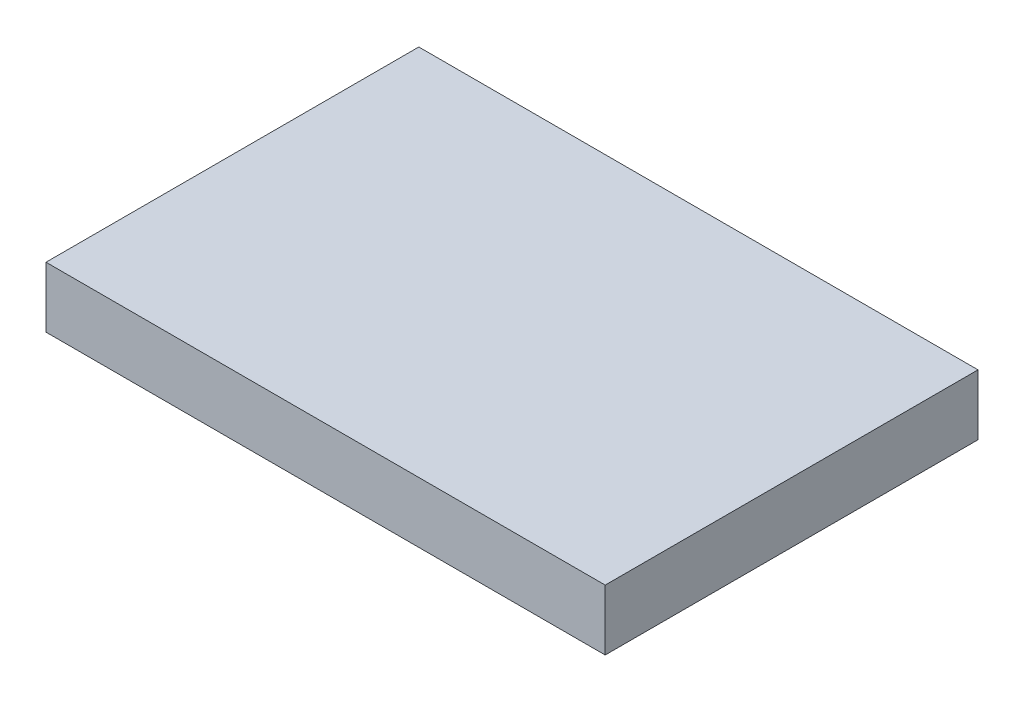
from build123d import *

# Parameters (mm, degrees)
SKETCH1_W           = 60
SKETCH1_H           = 40
BOSS_EXTRUDE1_DEPTH = 6.5


with BuildPart() as part:
    # Sketch1 → Boss-Extrude1 (new body)
    with BuildSketch(Plane(origin=(0, 0, 0), x_dir=(1, 0, 0), z_dir=(0, 1, 0))):
        Rectangle(SKETCH1_W, SKETCH1_H)
    extrude(amount=BOSS_EXTRUDE1_DEPTH)


solid = part.part
